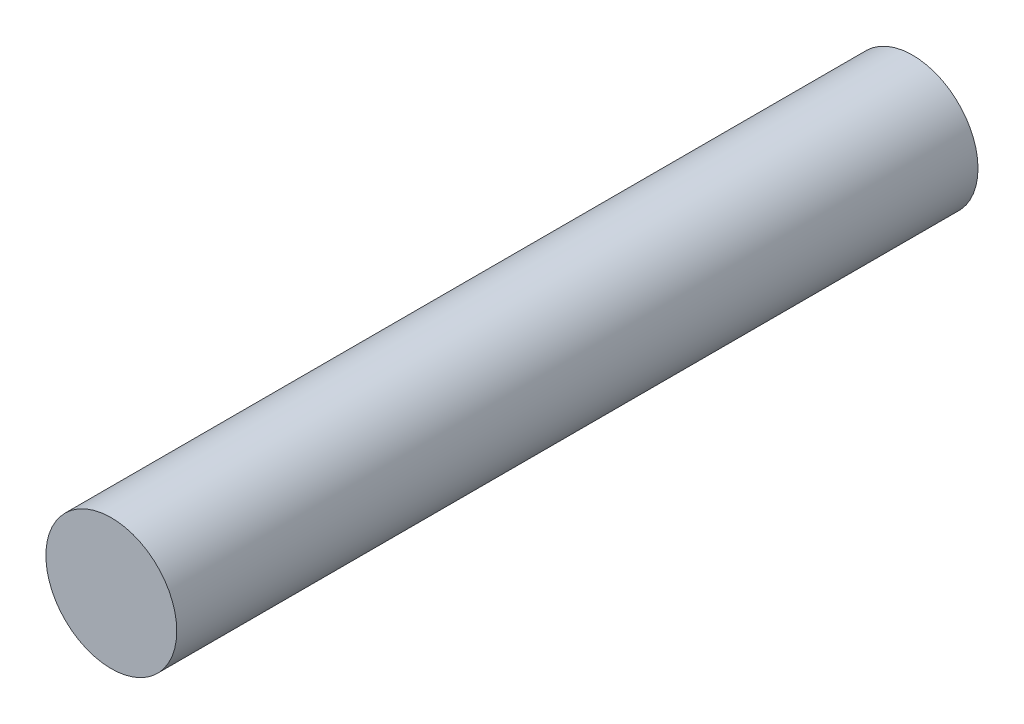
from build123d import *

# Parameters (mm, degrees)
SKETCH1_R           = 2.45
BOSS_EXTRUDE1_DEPTH = 30


with BuildPart() as part:
    # Sketch1 → Boss-Extrude1 (new body)
    with BuildSketch(Plane.XY):
        Circle(SKETCH1_R)
    extrude(amount=BOSS_EXTRUDE1_DEPTH)


solid = part.part
